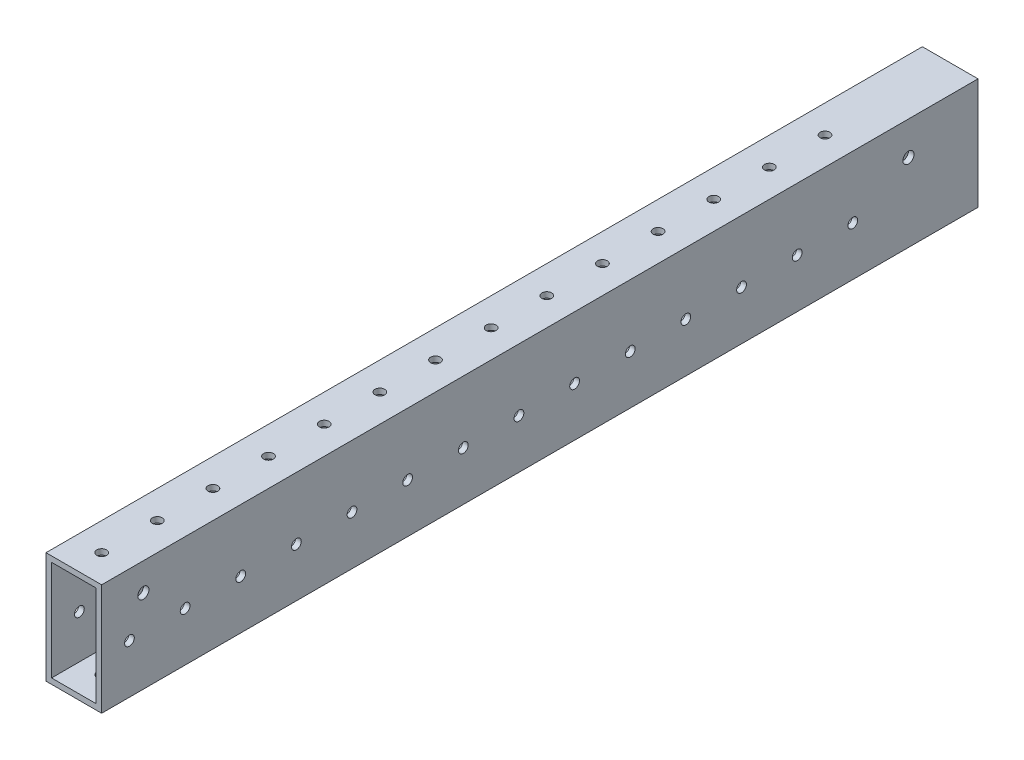
from build123d import *

# Parameters (mm, degrees)
SKETCH_1_W          = 20
SKETCH_1_H          = 40
SKETCH_1_W_2        = 16
SKETCH_1_H_2        = 36
EXTRUDE_1_DEPTH     = 315
SKETCH_2_R          = 2
CUT_EXTRUDE_1_DEPTH = 319.158765399
SKETCH_3_R          = 1.75
CUT_EXTRUDE_2_DEPTH = 319.158765399
SKETCH_5_R          = 1.75
CUT_EXTRUDE_4_DEPTH = 319.158765399


with BuildPart() as part:
    # 草图1 → 凸台-拉伸1 (new body)
    with BuildSketch(Plane.XY):
        with Locations((10, 20)):
            Rectangle(SKETCH_1_W, SKETCH_1_H)
        with Locations((10, 20)):
            Rectangle(SKETCH_1_W_2, SKETCH_1_H_2, mode=Mode.SUBTRACT)
    extrude(amount=EXTRUDE_1_DEPTH)

    # 草图2 → 切除-拉伸1 (cut, through all)
    with BuildSketch(Plane(origin=(20, 0, 0), x_dir=(0, 0, -1), z_dir=(1, 0, 0))):
        with Locations((-300, 30)):
            Circle(SKETCH_2_R)
        with Locations((-25, 28)):
            Circle(SKETCH_2_R)
    extrude(amount=-CUT_EXTRUDE_1_DEPTH, mode=Mode.SUBTRACT)

    # 草图3 → 切除-拉伸2 (cut, through all)
    with BuildSketch(Plane(origin=(0, 0, 0), x_dir=(-1, 0, 0), z_dir=(0, -1, 0))):
        with Locations(Location((-10, -305, 0), (0, 0, 90))):
            Circle(SKETCH_3_R)
        with Locations(Location((-10, -285, 0), (0, 0, 90))):
            Circle(SKETCH_3_R)
        with Locations(Location((-10, -265, 0), (0, 0, 90))):
            Circle(SKETCH_3_R)
        with Locations(Location((-10, -245, 0), (0, 0, 90))):
            Circle(SKETCH_3_R)
        with Locations(Location((-10, -225, 0), (0, 0, 90))):
            Circle(SKETCH_3_R)
        with Locations(Location((-10, -205, 0), (0, 0, 90))):
            Circle(SKETCH_3_R)
        with Locations(Location((-10, -185, 0), (0, 0, 90))):
            Circle(SKETCH_3_R)
        with Locations(Location((-10, -165, 0), (0, 0, 90))):
            Circle(SKETCH_3_R)
        with Locations(Location((-10, -145, 0), (0, 0, 90))):
            Circle(SKETCH_3_R)
        with Locations(Location((-10, -125, 0), (0, 0, 90))):
            Circle(SKETCH_3_R)
        with Locations(Location((-10, -105, 0), (0, 0, 90))):
            Circle(SKETCH_3_R)
        with Locations(Location((-10, -85, 0), (0, 0, 90))):
            Circle(SKETCH_3_R)
        with Locations(Location((-10, -65, 0), (0, 0, 90))):
            Circle(SKETCH_3_R)
        with Locations(Location((-10, -45, 0), (0, 0, 90))):
            Circle(SKETCH_3_R)
    extrude(amount=-CUT_EXTRUDE_2_DEPTH, mode=Mode.SUBTRACT)

    # 草图5 → 切除-拉伸4 (cut, through all)
    with BuildSketch(Plane(origin=(20, 0, 0), x_dir=(0, 0, -1), z_dir=(1, 0, 0))):
        with Locations((-305, 17.65)):
            Circle(SKETCH_5_R)
        with Locations((-285, 17.65)):
            Circle(SKETCH_5_R)
        with Locations((-265, 17.65)):
            Circle(SKETCH_5_R)
        with Locations((-245, 17.65)):
            Circle(SKETCH_5_R)
        with Locations((-225, 17.65)):
            Circle(SKETCH_5_R)
        with Locations((-205, 17.65)):
            Circle(SKETCH_5_R)
        with Locations((-185, 17.65)):
            Circle(SKETCH_5_R)
        with Locations((-165, 17.65)):
            Circle(SKETCH_5_R)
        with Locations((-145, 17.65)):
            Circle(SKETCH_5_R)
        with Locations((-125, 17.65)):
            Circle(SKETCH_5_R)
        with Locations((-105, 17.65)):
            Circle(SKETCH_5_R)
        with Locations((-85, 17.65)):
            Circle(SKETCH_5_R)
        with Locations((-65, 17.65)):
            Circle(SKETCH_5_R)
        with Locations((-45, 17.65)):
            Circle(SKETCH_5_R)
    extrude(amount=-CUT_EXTRUDE_4_DEPTH, mode=Mode.SUBTRACT)


solid = part.part
